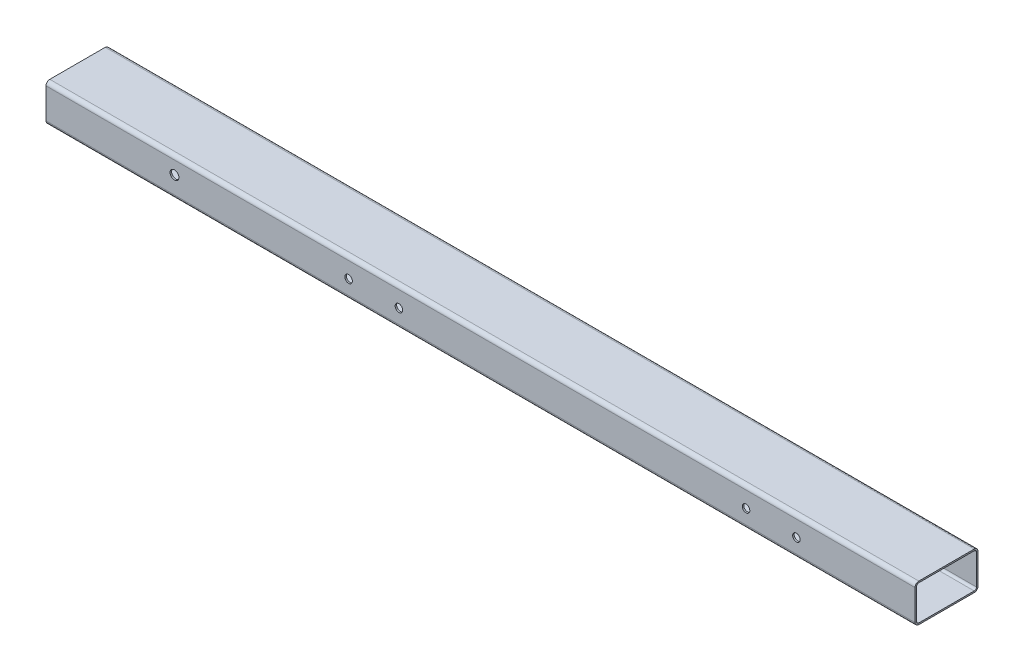
from build123d import *

# Parameters (mm, degrees)
TUBO_RETANGULAR_50_X_30_X_2_6_1_DEPTH = 689.8
ESBO_O5_R                             = 3
CORTE_EXTRUS_O4_DEPTH                 = 692.772390313
ESBO_O6_R                             = 3.5
CORTE_EXTRUS_O5_DEPTH                 = 692.772390313


with BuildPart() as part:
    # Sketch1 → Tubo retangular 50 X 30 X 2.6(1) (new body)
    with BuildSketch(Plane.YZ):
        with BuildLine():
            Line((-12, -25), (12, -25))
            ThreePointArc((12, -25), (14.121320344, -24.121320344), (15, -22))
            Line((15, -22), (15, 22))
            ThreePointArc((15, 22), (14.121320344, 24.121320344), (12, 25))
            Line((12, 25), (-12, 25))
            ThreePointArc((-12, 25), (-14.121320344, 24.121320344), (-15, 22))
            Line((-15, 22), (-15, -22))
            ThreePointArc((-15, -22), (-14.121320344, -24.121320344), (-12, -25))
        make_face()
        with BuildLine():
            Line((-12, -23.8), (12, -23.8))
            ThreePointArc((12, -23.8), (13.272792206, -23.272792206), (13.8, -22))
            Line((13.8, -22), (13.8, 22))
            ThreePointArc((13.8, 22), (13.272792206, 23.272792206), (12, 23.8))
            Line((12, 23.8), (-12, 23.8))
            ThreePointArc((-12, 23.8), (-13.272792206, 23.272792206), (-13.8, 22))
            Line((-13.8, 22), (-13.8, -22))
            ThreePointArc((-13.8, -22), (-13.272792206, -23.272792206), (-12, -23.8))
        make_face(mode=Mode.SUBTRACT)
    extrude(amount=TUBO_RETANGULAR_50_X_30_X_2_6_1_DEPTH)

    # Esboço5 → Corte-extrusão4 (cut, through all)
    with BuildSketch(Plane.XY.offset(25)):
        with Locations((280.1625, -0.6530272)):
            Circle(ESBO_O5_R)
        with Locations((240.1625, -0.6530272)):
            Circle(ESBO_O5_R)
        with Locations((595.6625, -0.6530272)):
            Circle(ESBO_O5_R)
        with Locations((555.6625, -0.6530272)):
            Circle(ESBO_O5_R)
    extrude(amount=-CORTE_EXTRUS_O4_DEPTH, mode=Mode.SUBTRACT)

    # Esboço6 → Corte-extrusão5 (cut, through all)
    with BuildSketch(Plane.XY.offset(25)):
        with Locations((102, 1.769410095)):
            Circle(ESBO_O6_R)
    extrude(amount=-CORTE_EXTRUS_O5_DEPTH, mode=Mode.SUBTRACT)


solid = part.part
